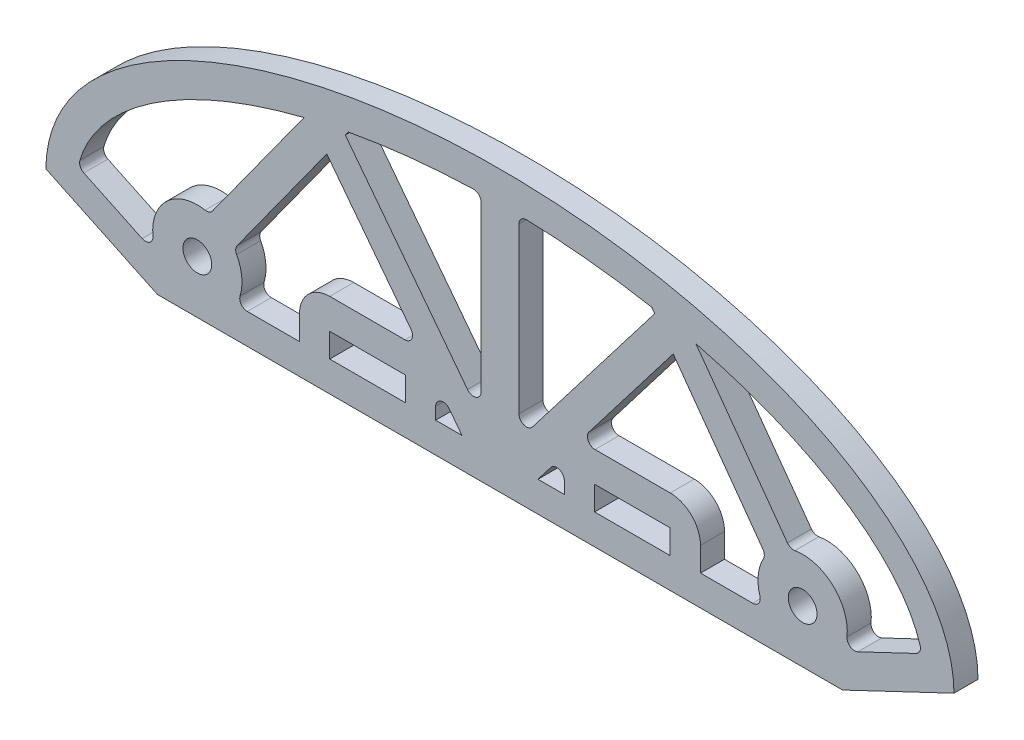
from build123d import *

# Parameters (mm, degrees)
SKETCH3_R           = 1.9
SKETCH3_W           = 10
SKETCH3_H           = 3.175
BOSS_EXTRUDE1_DEPTH = 3.175
CUT_EXTRUDE2_DEPTH  = 3.175
FILLET1_R           = 1


with BuildPart() as part:
    # Sketch3 → Boss-Extrude1 (new body)
    with BuildSketch(Plane.XY):
        with BuildLine():
            Line((-20, 22.2), (-5.265913382, 15.2))
            Line((-5.265913382, 15.2), (85.265913382, 15.2))
            Line((85.265913382, 15.2), (100, 22.2))
            add(Edge.make_bspline(
                [(100, 22.2), (100, 52.2), (40, 52.2), (-20, 52.2), (-20, 22.2)],
                knots=[0, 0, 0, 1.570796327, 1.570796327, 3.141592654, 3.141592654, 3.141592654], degree=2, weights=[1, 0.707106781, 1, 0.707106781, 1]))
        make_face()
        with Locations((80, 22.2)):
            Circle(SKETCH3_R, mode=Mode.SUBTRACT)
        with Locations((0, 22.2)):
            Circle(SKETCH3_R, mode=Mode.SUBTRACT)
        with Locations((57.5, 20.7875)):
            Rectangle(SKETCH3_W, SKETCH3_H, mode=Mode.SUBTRACT)
        with Locations((22.5, 20.7875)):
            Rectangle(SKETCH3_W, SKETCH3_H, mode=Mode.SUBTRACT)
    extrude(amount=BOSS_EXTRUDE1_DEPTH)

    # Sketch4 → Cut-Extrude2 (cut)
    with BuildSketch(Plane.XY.offset(3.175)):
        with BuildLine():
            add(Edge.make_bspline(
                [(14.095204553, 45.14170438), (14.027167539, 45.124660245), (12.59427251, 44.763918607), (8.141706785, 43.52322691), (1.343643744, 40.991251246), (-5.612092877, 37.237314228), (-10.011354224, 33.755700412), (-12.616109963, 30.89895808), (-14.112671896, 28.757994703), (-14.989236231, 27.004881876), (-15.483690135, 25.621903057), (-15.662221651, 24.948003316), (-15.737490617, 24.603399829)],
                knots=[5.176856544, 5.176856544, 5.176856544, 5.176856544, 5.180830678, 5.260645152, 5.443397209, 5.626149267, 5.808901324, 5.900277353, 5.991653381, 6.08302941, 6.128717424, 6.174405439, 6.174405439, 6.174405439, 6.174405439], degree=3))
            Line((-15.737490617, 24.603399829), (-5.323201387, 19.655687324))
            ThreePointArc((-5.323201387, 19.655687324), (-4.504241466, 26.010749114), (1.627356195, 27.871129677))
            Line((1.627356195, 27.871129677), (14.095204553, 45.14170438))
        make_face()
        with BuildLine():
            Line((17.109688705, 42.483591967), (4.870549407, 25.529827094))
            ThreePointArc((4.870549407, 25.529827094), (5.896761738, 22.395450769), (5.080354318, 19.2))
            Line((5.080354318, 19.2), (13.5, 19.2))
            Line((13.5, 19.2), (13.5, 22.375))
            ThreePointArc((13.5, 22.375), (14.671572875, 25.203427125), (17.5, 26.375))
            Line((17.5, 26.375), (27.44436289, 26.375))
            ThreePointArc((27.44436289, 26.375), (28.341254025, 26.932748609), (28.237665594, 27.983827414))
            Line((28.237665594, 27.983827414), (17.109688705, 42.483591967))
        make_face()
        with BuildLine():
            Line((19.943756242, 46.409367587), (19.553696687, 45.869053614))
            Line((19.553696687, 45.869053614), (37.5, 22.485003195))
            Line((37.5, 22.485003195), (37.5, 48.173008084))
            add(Edge.make_bspline(
                [(37.5, 48.173008084), (36.62493347, 48.154099582), (33.22316823, 48.041855486), (27.344057019, 47.583971569), (22.426465209, 46.865462719), (20.002503893, 46.4202133), (19.943756242, 46.409367587)],
                knots=[4.755506932, 4.755506932, 4.755506932, 4.755506932, 4.800814715, 4.931825193, 5.06283567, 5.066091918, 5.066091918, 5.066091918, 5.066091918], degree=3))
        make_face()
        with BuildLine():
            Line((34.978894261, 19.2), (33.293302704, 21.396327414))
            ThreePointArc((33.293302704, 21.396327414), (32.178521155, 21.734416761), (31.5, 20.7875))
            Line((31.5, 20.7875), (31.5, 19.2))
            Line((31.5, 19.2), (34.978894261, 19.2))
        make_face()
        with BuildLine():
            add(Edge.make_bspline(
                [(60.056243758, 46.409367587), (59.997496107, 46.4202133), (57.573534791, 46.865462719), (52.655942981, 47.583971569), (46.77683177, 48.041855486), (43.37506653, 48.154099582), (42.5, 48.173008084)],
                knots=[4.358686043, 4.358686043, 4.358686043, 4.358686043, 4.36194229, 4.492952768, 4.623963246, 4.669271029, 4.669271029, 4.669271029, 4.669271029], degree=3))
            Line((42.5, 48.173008084), (42.5, 22.485003195))
            Line((42.5, 22.485003195), (60.446303313, 45.869053614))
            Line((60.446303313, 45.869053614), (60.056243758, 46.409367587))
        make_face()
        with BuildLine():
            Line((46.706697296, 21.396327414), (45.021105739, 19.2))
            Line((45.021105739, 19.2), (48.5, 19.2))
            Line((48.5, 19.2), (48.5, 20.7875))
            ThreePointArc((48.5, 20.7875), (47.821478845, 21.734416761), (46.706697296, 21.396327414))
        make_face()
        with BuildLine():
            Line((75.129450593, 25.529827094), (62.890311295, 42.483591967))
            Line((62.890311295, 42.483591967), (51.762334406, 27.983827414))
            ThreePointArc((51.762334406, 27.983827414), (51.658745975, 26.932748609), (52.55563711, 26.375))
            Line((52.55563711, 26.375), (62.5, 26.375))
            ThreePointArc((62.5, 26.375), (65.328427125, 25.203427125), (66.5, 22.375))
            Line((66.5, 22.375), (66.5, 19.2))
            Line((66.5, 19.2), (74.919645682, 19.2))
            ThreePointArc((74.919645682, 19.2), (74.103238262, 22.395450769), (75.129450593, 25.529827094))
        make_face()
        with BuildLine():
            add(Edge.make_bspline(
                [(95.737490617, 24.603399829), (95.662221651, 24.948003316), (95.483690135, 25.621903057), (94.989236231, 27.004881876), (94.112671896, 28.757994703), (92.616109963, 30.89895808), (90.011354224, 33.755700412), (85.612092877, 37.237314228), (78.656356256, 40.991251246), (71.858293215, 43.52322691), (67.40572749, 44.763918607), (65.972832461, 45.124660245), (65.904795447, 45.14170438)],
                knots=[3.250372522, 3.250372522, 3.250372522, 3.250372522, 3.296060537, 3.341748551, 3.43312458, 3.524500608, 3.615876637, 3.798628694, 3.981380751, 4.164132809, 4.243947283, 4.247921417, 4.247921417, 4.247921417, 4.247921417], degree=3))
            Line((65.904795447, 45.14170438), (78.372643805, 27.871129677))
            ThreePointArc((78.372643805, 27.871129677), (84.504241466, 26.010749114), (85.323201387, 19.655687324))
            Line((85.323201387, 19.655687324), (95.737490617, 24.603399829))
        make_face()
    extrude(amount=-CUT_EXTRUDE2_DEPTH, mode=Mode.SUBTRACT)

    # Fillet1
    fillet1_edges = [part.edges().sort_by_distance(p)[0] for p in [
        (95.737490617, 24.603399829, 1.5875),
        (-15.737490617, 24.603399829, 1.5875),
        (-5.323201387, 19.655687324, 1.5875),
        (5.080354318, 19.2, 1.5875),
        (4.870549407, 25.529827094, 1.5875),
        (1.627356195, 27.871129677, 1.5875),
        (37.5, 22.485003195, 1.5875),
        (37.5, 48.173008084, 1.5875),
        (42.5, 48.173008084, 1.5875),
        (42.5, 22.485003195, 1.5875),
        (85.323201387, 19.655687324, 1.5875),
        (78.372643805, 27.871129677, 1.5875),
        (74.919645682, 19.2, 1.5875),
        (75.129450593, 25.529827094, 1.5875),
    ]]
    fillet(fillet1_edges, radius=FILLET1_R)


solid = part.part
